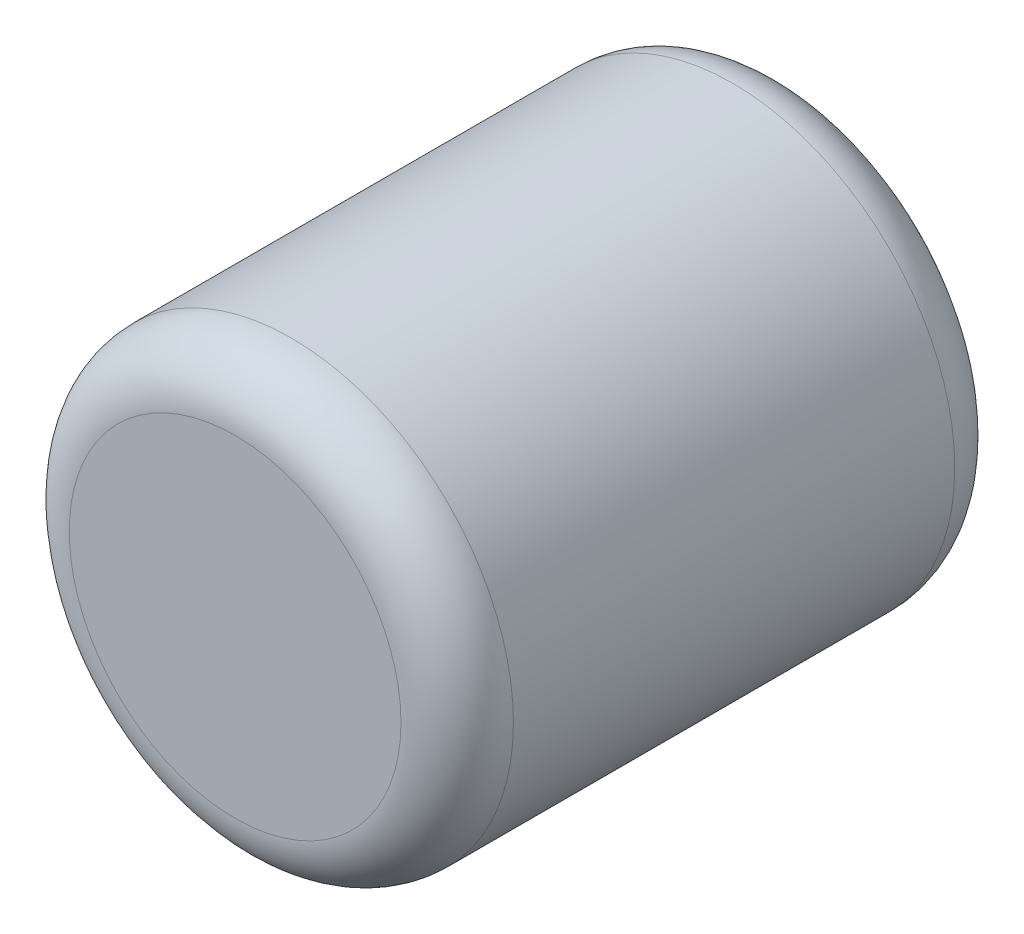
from build123d import *

# Parameters (mm, degrees)
CROQUIS1_R              = 3.95
SALIENTE_EXTRUIR1_DEPTH = 9.85
REDONDEO1_R             = 1


with BuildPart() as part:
    # Croquis1 → Saliente-Extruir1 (new body)
    with BuildSketch(Plane.XY):
        Circle(CROQUIS1_R)
    extrude(amount=SALIENTE_EXTRUIR1_DEPTH)

    # Redondeo1
    redondeo1_edges = [part.edges().sort_by_distance(p)[0] for p in [
        (-3.95, 0, 0),
        (-3.95, 0, 9.85),
    ]]
    fillet(redondeo1_edges, radius=REDONDEO1_R)


solid = part.part
